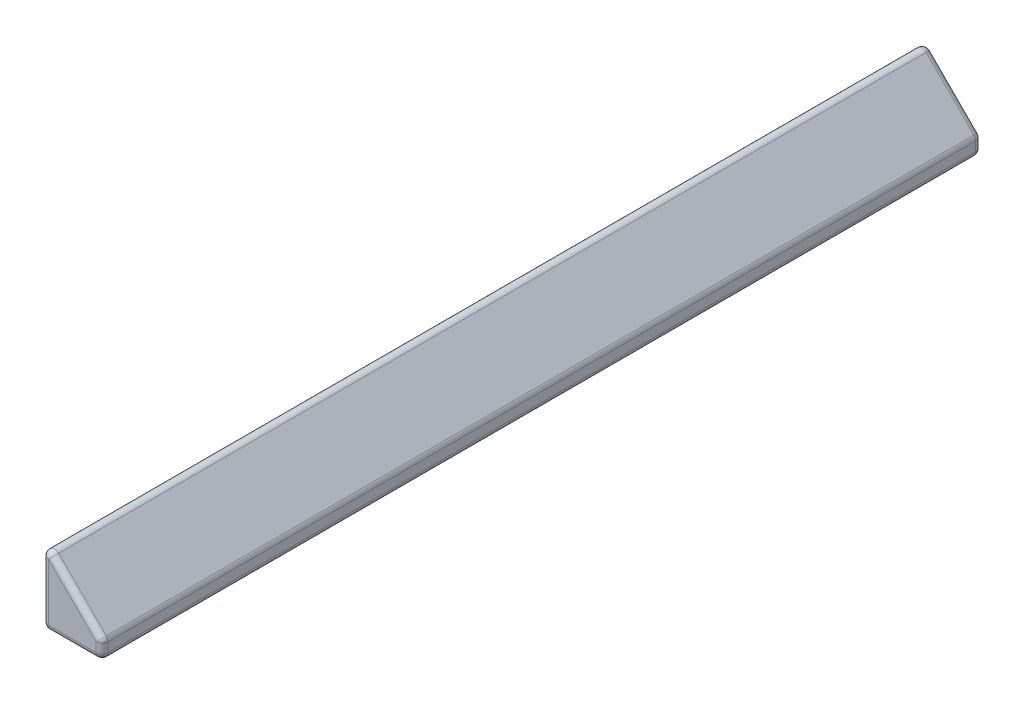
from build123d import *

# Parameters (mm, degrees)
BOSS_EXTRUDE1_DEPTH      = 16.315787
BOSS_EXTRUDE1_DEPTH_BACK = 13.184213
FILLET1_R                = 0.2


with BuildPart() as part:
    # Sketch1 → Boss-Extrude1 (new, two sides: drawn at the far end of the back side and taken through both)
    with BuildSketch(Plane.XY.offset(-BOSS_EXTRUDE1_DEPTH_BACK)):
        Polygon((220, 2.6), (220, 0), (222, 0), (222, 0.6), align=None)
    extrude(amount=BOSS_EXTRUDE1_DEPTH + BOSS_EXTRUDE1_DEPTH_BACK)

    # Fillet1
    fillet1_edges = [part.edges().sort_by_distance(p)[0] for p in [
        (222, 0.3, 16.315787),
        (221, 1.6, 16.315787),
        (220, 1.3, 16.315787),
        (221, 0, 16.315787),
        (222, 0.3, -13.184213),
        (222, 0.6, 1.565787),
        (221, 1.6, -13.184213),
        (220, 2.6, 1.565787),
        (220, 1.3, -13.184213),
        (220, 0, 1.565787),
        (221, 0, -13.184213),
        (222, 0, 1.565787),
    ]]
    fillet(fillet1_edges, radius=FILLET1_R)


solid = part.part
